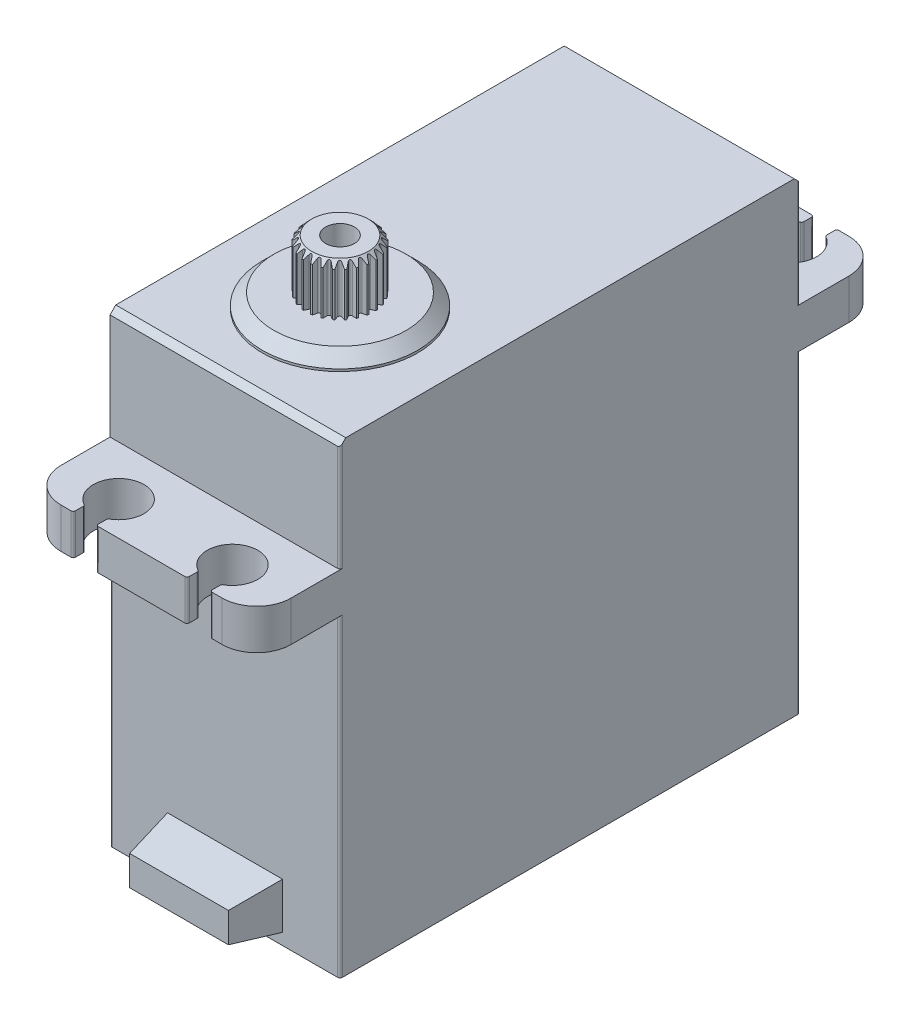
from build123d import *

# Parameters (mm, degrees)
BOSS_EXTRUDE1_DEPTH       = 20
SKETCH2_R                 = 6.75
BOSS_EXTRUDE2_DEPTH       = 1.2
CHAMFER1_SIZE             = 1
FILLET1_R                 = 3
BOSS_EXTRUDE3_START       = -41.7
SKETCH3_R                 = 2.95
BOSS_EXTRUDE3_DEPTH       = 46
CHAMFER2_SIZE             = 0.5
CUT_EXTRUDE1_DEPTH        = 4.3
CIRPATTERN3_COUNT         = 25
M3X0_5_TAPPED_HOLE1_D     = 2.5
M3X0_5_TAPPED_HOLE1_DEPTH = 4
M3X0_5_TAPPED_HOLE1_TIP   = 0.751075774
SKETCH9_W                 = 2
SKETCH9_H                 = 1.785781894
CUT_EXTRUDE2_DEPTH        = 46
FILLET2_R                 = 0.2
SKETCH10_W                = 10
SKETCH10_H                = 4
BOSS_EXTRUDE4_DEPTH       = 4
BOSS_EXTRUDE4_TAPER       = 10


with BuildPart() as part:
    # Sketch1 → Boss-Extrude1 (new body)
    with BuildSketch(Plane(origin=(0, 0, 0), x_dir=(0, 0, -1), z_dir=(1, 0, 0))):
        Polygon((0, 0), (40, 0), (40, 27.3), (47.25, 27.3), (47.25, 30.8), (40, 30.8), (40, 40), (39.5, 40.5), (0.5, 40.5), (0, 40), (0, 30.8), (-7.25, 30.8), (-7.25, 27.3), (0, 27.3), align=None)
    extrude(amount=BOSS_EXTRUDE1_DEPTH)

    # Sketch2 → Boss-Extrude2 (add)
    with BuildSketch(Plane(origin=(0, 40.5, 0), x_dir=(1, 0, 0), z_dir=(0, 1, 0))):
        with Locations(Location((10, 10, 0), (0, 0, 90))):
            Circle(SKETCH2_R)
    extrude(amount=BOSS_EXTRUDE2_DEPTH)

    # Chamfer1
    chamfer1_edges = [part.edges().sort_by_distance(p)[0] for p in [
        (10, 41.7, -3.25),
    ]]
    chamfer(chamfer1_edges, length=CHAMFER1_SIZE)

    # Fillet1
    fillet1_edges = [part.edges().sort_by_distance(p)[0] for p in [
        (0, 29.05, 7.25),
        (0, 29.05, -47.25),
        (20, 29.05, -47.25),
        (20, 29.05, 7.25),
    ]]
    fillet(fillet1_edges, radius=FILLET1_R)

    # Sketch3 → Boss-Extrude3 (add)
    with BuildSketch(Plane(origin=(0, 41.7, 0), x_dir=(1, 0, 0), z_dir=(0, 1, 0)).offset(BOSS_EXTRUDE3_START)):
        with Locations(Location((10, 10, 0), (0, 0, 270))):
            Circle(SKETCH3_R)
    extrude(amount=BOSS_EXTRUDE3_DEPTH)

    # Chamfer2
    chamfer2_edges = [part.edges().sort_by_distance(p)[0] for p in [
        (10, 46, -12.95),
    ]]
    chamfer(chamfer2_edges, length=CHAMFER2_SIZE)

    # Sketch4 → Cut-Extrude1 (cut)
    with BuildSketch(Plane(origin=(0, 46, 0), x_dir=(1, 0, 0), z_dir=(0, 1, 0))):
        with BuildLine():
            Line((-21.167019616, 88.70505756), (10, 12.95))
            Line((10, 12.95), (10.135108557, 12.621602974))
            ThreePointArc((10.135108557, 12.621602974), (10.258572945, 12.529452015), (10.398129031, 12.594715736))
            Line((10.398129031, 12.594715736), (10.59688938, 12.888983051))
            Line((10.59688938, 12.888983051), (56.44718794, 80.770953997))
            Line((56.44718794, 80.770953997), (73.108045462, 243.753355676))
            Line((73.108045462, 243.753355676), (-4.506162094, 251.687459238))
            Line((-4.506162094, 251.687459238), (-21.167019616, 88.70505756))
        make_face()
    cut_extrude1 = extrude(amount=-CUT_EXTRUDE1_DEPTH, mode=Mode.SUBTRACT)

    # CirPattern3: Cut-Extrude1 ×25 about axis
    cirpattern3_axis = Axis((10, 0, -10), (0, 1, 0))
    for i in range(1, CIRPATTERN3_COUNT):
        add(cut_extrude1.rotate(cirpattern3_axis, i * 360 / CIRPATTERN3_COUNT), mode=Mode.SUBTRACT)

    # M3x0.5 Tapped Hole1
    with Locations(Plane(origin=(0, 46, 0), x_dir=(1, 0, 0), z_dir=(0, 1, 0))):
        with Locations((10, 10)):
            Hole(M3X0_5_TAPPED_HOLE1_D / 2, depth=M3X0_5_TAPPED_HOLE1_DEPTH)
            with Locations((0, 0, -(M3X0_5_TAPPED_HOLE1_DEPTH + M3X0_5_TAPPED_HOLE1_TIP / 2))):  # 118° drill point
                Cone(0, M3X0_5_TAPPED_HOLE1_D / 2, M3X0_5_TAPPED_HOLE1_TIP, mode=Mode.SUBTRACT)

    # Sketch9 → Cut-Extrude2 (cut)
    with BuildSketch(Plane(origin=(0, 30.8, 0), x_dir=(1, 0, 0), z_dir=(0, 1, 0))):
        with BuildLine():
            ThreePointArc((17.15, -4.3), (13.801087471, -2.423833696), (13.95, -6.259591794))
            Line((13.95, -6.259591794), (15.95, -6.259591794))
            ThreePointArc((15.95, -6.259591794), (16.826166304, -5.448912529), (17.15, -4.3))
        make_face()
        with BuildLine():
            Line((15.95, -6.259591794), (13.95, -6.259591794))
            ThreePointArc((13.95, -6.259591794), (14.95, -6.5), (15.95, -6.259591794))
        make_face()
        with BuildLine():
            Line((13.95, -6.259591794), (13.95, -7.25))
            Line((13.95, -7.25), (15.95, -7.25))
            Line((15.95, -7.25), (15.95, -6.259591794))
            ThreePointArc((15.95, -6.259591794), (14.95, -6.5), (13.95, -6.259591794))
        make_face()
        with Locations((14.95, -8.142890947)):
            Rectangle(SKETCH9_W, SKETCH9_H)
        with BuildLine():
            ThreePointArc((7.25, -4.3), (3.901087471, -2.423833696), (4.05, -6.259591794))
            Line((4.05, -6.259591794), (6.05, -6.259591794))
            ThreePointArc((6.05, -6.259591794), (6.926166304, -5.448912529), (7.25, -4.3))
        make_face()
        with BuildLine():
            Line((6.05, -6.259591794), (4.05, -6.259591794))
            ThreePointArc((4.05, -6.259591794), (5.05, -6.5), (6.05, -6.259591794))
        make_face()
        with BuildLine():
            ThreePointArc((6.05, -6.259591794), (5.05, -6.5), (4.05, -6.259591794))
            Line((4.05, -6.259591794), (4.05, -7.25))
            Line((4.05, -7.25), (6.05, -7.25))
            Line((6.05, -7.25), (6.05, -6.259591794))
        make_face()
        with Locations((5.05, -8.142890947)):
            Rectangle(SKETCH9_W, SKETCH9_H)
        with BuildLine():
            ThreePointArc((17.15, 44.3), (16.826166304, 45.448912529), (15.95, 46.259591794))
            Line((15.95, 46.259591794), (13.95, 46.259591794))
            ThreePointArc((13.95, 46.259591794), (13.801087471, 42.423833696), (17.15, 44.3))
        make_face()
        with BuildLine():
            Line((13.95, 46.259591794), (15.95, 46.259591794))
            ThreePointArc((15.95, 46.259591794), (14.95, 46.5), (13.95, 46.259591794))
        make_face()
        with BuildLine():
            ThreePointArc((13.95, 46.259591794), (14.95, 46.5), (15.95, 46.259591794))
            Line((15.95, 46.259591794), (15.95, 49.035781894))
            Line((15.95, 49.035781894), (13.95, 49.035781894))
            Line((13.95, 49.035781894), (13.95, 46.259591794))
        make_face()
        with BuildLine():
            ThreePointArc((7.25, 44.3), (6.926166304, 45.448912529), (6.05, 46.259591794))
            Line((6.05, 46.259591794), (4.05, 46.259591794))
            ThreePointArc((4.05, 46.259591794), (3.901087471, 42.423833696), (7.25, 44.3))
        make_face()
        with BuildLine():
            Line((4.05, 46.259591794), (6.05, 46.259591794))
            ThreePointArc((6.05, 46.259591794), (5.05, 46.5), (4.05, 46.259591794))
        make_face()
        with BuildLine():
            ThreePointArc((4.05, 46.259591794), (5.05, 46.5), (6.05, 46.259591794))
            Line((6.05, 46.259591794), (6.05, 49.035781894))
            Line((6.05, 49.035781894), (4.05, 49.035781894))
            Line((4.05, 49.035781894), (4.05, 46.259591794))
        make_face()
    extrude(amount=-CUT_EXTRUDE2_DEPTH, mode=Mode.SUBTRACT)

    # Fillet2
    fillet2_edges = [part.edges().sort_by_distance(p)[0] for p in [
        (20, 13.65, -40),
        (0, 35.4, -40),
        (0, 13.65, -40),
        (0, 13.65, 0),
        (20, 35.4, -40),
        (4.05, 29.05, 6.259591794),
        (6.05, 29.05, 6.259591794),
        (4.05, 29.05, 7.25),
        (6.05, 29.05, 7.25),
        (15.95, 29.05, -46.259591794),
        (13.95, 29.05, -46.259591794),
        (15.95, 29.05, -47.25),
        (13.95, 29.05, -47.25),
        (6.05, 29.05, -47.25),
        (4.05, 29.05, -46.259591794),
        (6.05, 29.05, -46.259591794),
        (4.05, 29.05, -47.25),
        (13.95, 29.05, 6.259591794),
        (15.95, 29.05, 6.259591794),
        (13.95, 29.05, 7.25),
        (15.95, 29.05, 7.25),
        (20, 35.4, 0),
        (20, 13.65, 0),
    ]]
    fillet(fillet2_edges, radius=FILLET2_R)

    # Sketch10 → Boss-Extrude4 (add)
    with BuildSketch(Plane.XY):
        with Locations((10, 3)):
            Rectangle(SKETCH10_W, SKETCH10_H)
    extrude(amount=BOSS_EXTRUDE4_DEPTH, taper=BOSS_EXTRUDE4_TAPER)


solid = part.part
